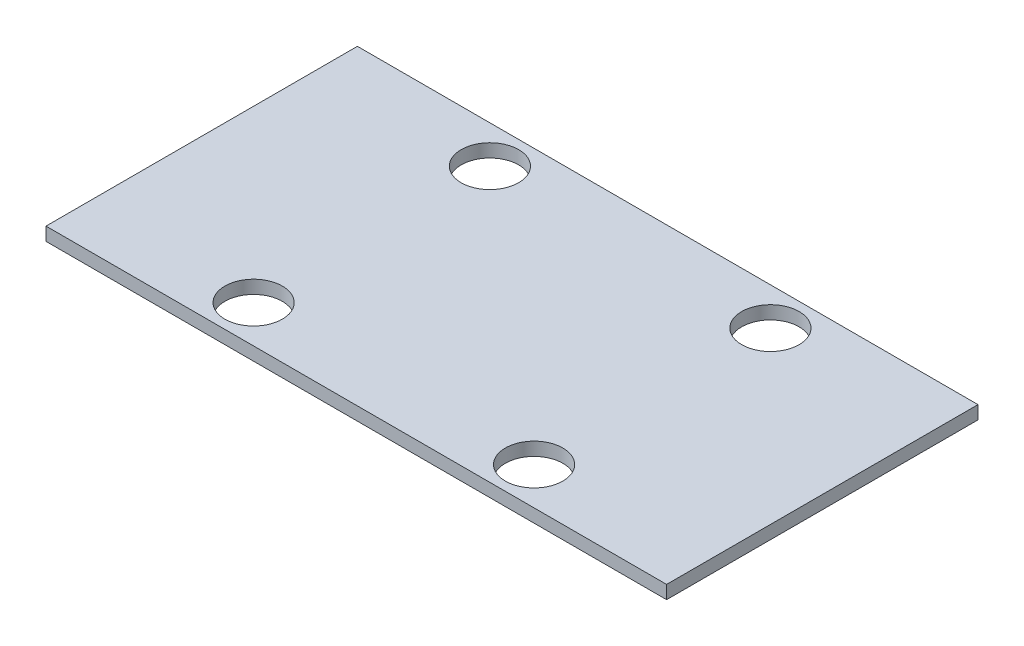
from build123d import *

# Parameters (mm, degrees)
SKETCH1_W           = 71.374
SKETCH1_H           = 35.814
BOSS_EXTRUDE1_DEPTH = 1.524
SKETCH2_R           = 3.302
CUT_EXTRUDE1_DEPTH  = 1.524


with BuildPart() as part:
    # Sketch1 → Boss-Extrude1 (new body)
    with BuildSketch(Plane(origin=(0, 0, 0), x_dir=(1, 0, 0), z_dir=(0, 1, 0))):
        with Locations((35.687, 17.907)):
            Rectangle(SKETCH1_W, SKETCH1_H)
    extrude(amount=BOSS_EXTRUDE1_DEPTH)

    # Sketch2 → Cut-Extrude1 (cut)
    with BuildSketch(Plane(origin=(0, 1.524, 0), x_dir=(1, 0, 0), z_dir=(0, 1, 0))):
        with Locations(Location((19.558, 4.318, 0), (0, 0, 270))):
            Circle(SKETCH2_R)
        with Locations(Location((51.816, 31.496, 0), (0, 0, 270))):
            Circle(SKETCH2_R)
        with Locations(Location((19.558, 31.496, 0), (0, 0, 270))):
            Circle(SKETCH2_R)
        with Locations(Location((51.816, 4.318, 0), (0, 0, 270))):
            Circle(SKETCH2_R)
    extrude(amount=-CUT_EXTRUDE1_DEPTH, mode=Mode.SUBTRACT)


solid = part.part
